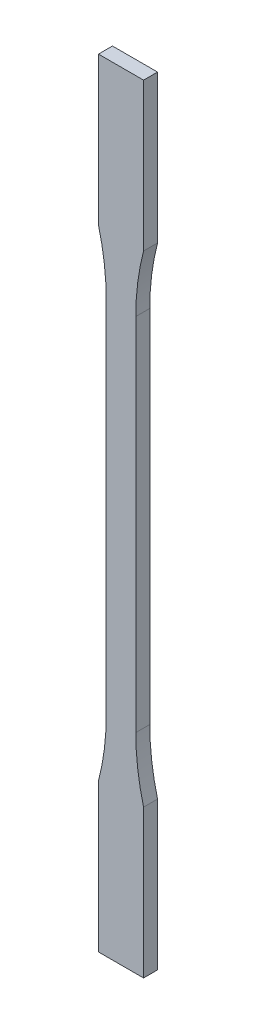
from build123d import *

# Parameters (mm, degrees)
SKETCH1_W               = 28.999999912
SKETCH1_H               = 499.999999996
BOSS_EXTRUDE1_DEPTH     = 4.500000017
CUT_EXTRUDE1_DEPTH      = 251.581822961
CUT_EXTRUDE1_DEPTH_BACK = 251.581822961


with BuildPart() as part:
    # Sketch1 → Boss-Extrude1 (new, symmetric)
    with BuildSketch(Plane.XY):
        Rectangle(SKETCH1_W, SKETCH1_H)
    extrude(amount=BOSS_EXTRUDE1_DEPTH, both=True)

    # Sketch2 → Cut-Extrude1 (cut, two sides: drawn at the far end of the back side and taken through both)
    with BuildSketch(Plane.XY.offset(4.500000017).offset(-CUT_EXTRUDE1_DEPTH_BACK)):
        with BuildLine():
            Line((-14.499999956, 76.870131123), (-14.499999956, -76.870131123))
            ThreePointArc((-14.499999956, -76.870131123), (-10.755098937, -96.202224739), (-9.50000005, -115.85365863))
            Line((-9.50000005, -115.85365863), (-9.50000005, 115.85365863))
            ThreePointArc((-9.50000005, 115.85365863), (-10.755098937, 96.202224739), (-14.499999956, 76.870131123))
        make_face()
        with BuildLine():
            ThreePointArc((9.50000005, -115.85365863), (10.755098937, -96.202224739), (14.499999956, -76.870131123))
            Line((14.499999956, -76.870131123), (14.499999956, 76.870131123))
            ThreePointArc((14.499999956, 76.870131123), (10.755098937, 96.202224739), (9.50000005, 115.85365863))
            Line((9.50000005, 115.85365863), (9.50000005, -115.85365863))
        make_face()
        with BuildLine():
            Line((14.499999956, -154.837186137), (14.499999956, -76.870131123))
            ThreePointArc((14.499999956, -76.870131123), (10.755098937, -96.202224739), (9.50000005, -115.85365863))
            ThreePointArc((9.50000005, -115.85365863), (10.755098937, -135.505092521), (14.499999956, -154.837186137))
        make_face()
        with BuildLine():
            ThreePointArc((-9.50000005, -115.85365863), (-10.755098937, -96.202224739), (-14.499999956, -76.870131123))
            Line((-14.499999956, -76.870131123), (-14.499999956, -154.837186137))
            ThreePointArc((-14.499999956, -154.837186137), (-10.755098937, -135.505092521), (-9.50000005, -115.85365863))
        make_face()
        with BuildLine():
            Line((-14.499999956, 154.837186137), (-14.499999956, 76.870131123))
            ThreePointArc((-14.499999956, 76.870131123), (-10.755098937, 96.202224739), (-9.50000005, 115.85365863))
            ThreePointArc((-9.50000005, 115.85365863), (-10.755098937, 135.505092521), (-14.499999956, 154.837186137))
        make_face()
        with BuildLine():
            ThreePointArc((9.50000005, 115.85365863), (10.755098937, 96.202224739), (14.499999956, 76.870131123))
            Line((14.499999956, 76.870131123), (14.499999956, 154.837186137))
            ThreePointArc((14.499999956, 154.837186137), (10.755098937, 135.505092521), (9.50000005, 115.85365863))
        make_face()
    extrude(amount=CUT_EXTRUDE1_DEPTH + CUT_EXTRUDE1_DEPTH_BACK, mode=Mode.SUBTRACT)


solid = part.part
